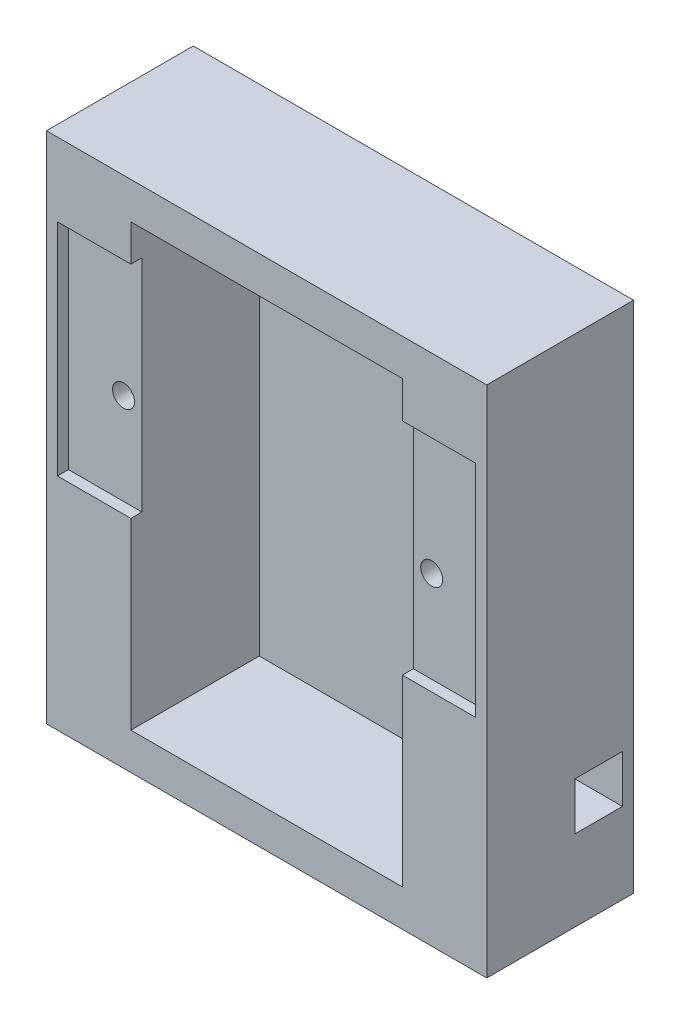
from build123d import *

# Parameters (mm, degrees)
SKETCH2_W           = 120
SKETCH2_H           = 140
BOSS_EXTRUDE1_DEPTH = 40
SKETCH3_W           = 74
SKETCH3_H           = 120
CUT_EXTRUDE1_DEPTH  = 35
SKETCH4_R           = 3
CUT_EXTRUDE2_DEPTH  = 40
SKETCH5_W           = 13
SKETCH5_H           = 13
CUT_EXTRUDE3_DEPTH  = 22
SKETCH6_W           = 20
SKETCH6_H           = 60
CUT_EXTRUDE4_DEPTH  = 3


with BuildPart() as part:
    # Sketch2 → Boss-Extrude1 (new body)
    with BuildSketch(Plane.XY):
        with Locations((-60, -70)):
            Rectangle(SKETCH2_W, SKETCH2_H)
    extrude(amount=BOSS_EXTRUDE1_DEPTH)

    # Sketch3 → Cut-Extrude1 (cut)
    with BuildSketch(Plane.XY.offset(40)):
        with Locations((-60, -70)):
            Rectangle(SKETCH3_W, SKETCH3_H)
    extrude(amount=-CUT_EXTRUDE1_DEPTH, mode=Mode.SUBTRACT)

    # Sketch4 → Cut-Extrude2 (cut)
    with BuildSketch(Plane.XY.offset(40)):
        with Locations((-102, -55)):
            Circle(SKETCH4_R)
        with Locations((-18, -55)):
            Circle(SKETCH4_R)
    extrude(amount=-CUT_EXTRUDE2_DEPTH, mode=Mode.SUBTRACT)

    # Sketch5 → Cut-Extrude3 (cut)
    with BuildSketch(Plane(origin=(0, 0, 0), x_dir=(0, 0, -1), z_dir=(1, 0, 0))):
        with Locations((-9.5, -111.5)):
            Rectangle(SKETCH5_W, SKETCH5_H)
    extrude(amount=-CUT_EXTRUDE3_DEPTH, mode=Mode.SUBTRACT)

    # Sketch6 → Cut-Extrude4 (cut)
    with BuildSketch(Plane.XY.offset(40)):
        with Locations((-107, -50)):
            Rectangle(SKETCH6_W, SKETCH6_H)
        with Locations((-13, -50)):
            Rectangle(SKETCH6_W, SKETCH6_H)
    extrude(amount=-CUT_EXTRUDE4_DEPTH, mode=Mode.SUBTRACT)


solid = part.part
